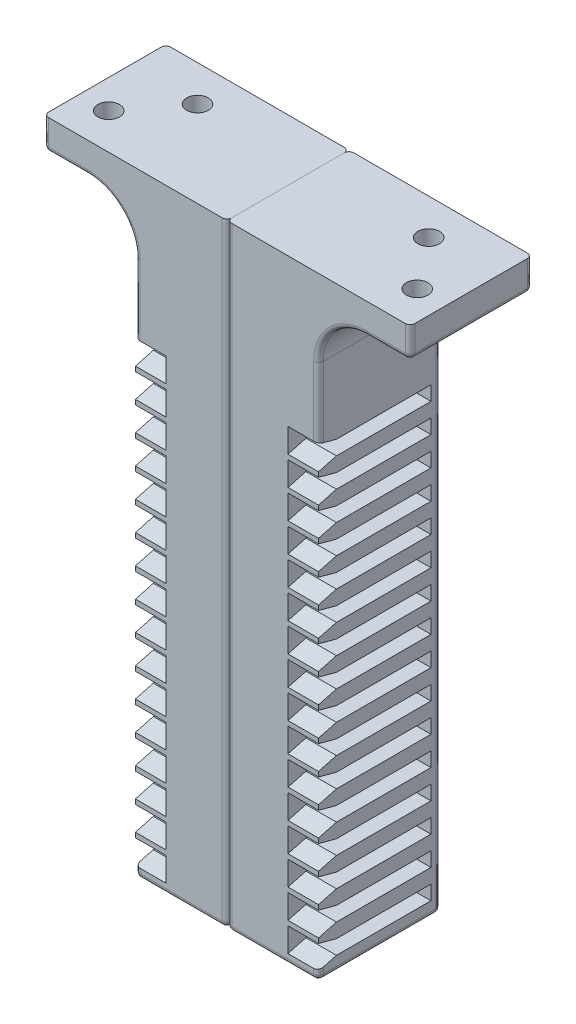
from build123d import *

# Parameters (mm, degrees)
BOSS_EXTRUDE1_DEPTH                             = 12.7
CHAMFER1_SIZE                                   = 1
CHAMFER1_SIZE2                                  = 3.732050808
FILLET1_R                                       = 10
FILLET2_R                                       = 1
CSK_FOR_M4_FLAT_HEAD_MACHINE_SCREW1_D           = 4.5
CSK_FOR_M4_FLAT_HEAD_MACHINE_SCREW1_CSINK_D     = 9.4
CSK_FOR_M4_FLAT_HEAD_MACHINE_SCREW1_CSINK_ANGLE = 90
BOSS_EXTRUDE2_REACH                             = 106.062
SKETCH5_W                                       = 6.35
SKETCH5_H                                       = 2
FILLET3_R                                       = 1


with BuildPart() as part:
    # Sketch1 → Boss-Extrude1 (new, symmetric)
    with BuildSketch(Plane.XY):
        Polygon((0, 0), (38.1, 0), (38.1, -6.35), (19.05, -6.35), (19.05, -31.75), (12.7, -31.75), (12.7, -34.75), (19.05, -34.75), (19.05, -37.75), (12.7, -37.75), (12.7, -40.75), (19.05, -40.75), (19.05, -43.75), (12.7, -43.75), (12.7, -46.75), (19.05, -46.75), (19.05, -49.75), (12.7, -49.75), (12.7, -52.75), (19.05, -52.75), (19.05, -55.75), (12.7, -55.75), (12.7, -58.75), (19.05, -58.75), (19.05, -61.75), (12.7, -61.75), (12.7, -64.75), (19.05, -64.75), (19.05, -67.75), (12.7, -67.75), (12.7, -70.75), (19.05, -70.75), (19.05, -73.75), (12.7, -73.75), (12.7, -76.75), (19.05, -76.75), (19.05, -79.75), (12.7, -79.75), (12.7, -82.75), (19.05, -82.75), (19.05, -85.75), (12.7, -85.75), (12.7, -88.75), (19.05, -88.75), (19.05, -91.75), (12.7, -91.75), (12.7, -94.75), (19.05, -94.75), (19.05, -97.75), (12.7, -97.75), (12.7, -100.75), (19.05, -100.75), (19.05, -103.75), (12.7, -103.75), (12.7, -106.75), (19.05, -106.75), (19.05, -109.75), (12.7, -109.75), (12.7, -112.75), (19.05, -112.75), (19.05, -115.75), (12.7, -115.75), (12.7, -118.75), (19.05, -118.75), (19.05, -121.75), (12.7, -121.75), (12.7, -124.75), (19.05, -124.75), (19.05, -127.75), (0, -127.75), align=None)
    extrude(amount=BOSS_EXTRUDE1_DEPTH, both=True)

    # Chamfer1
    chamfer1_edges = [part.edges().sort_by_distance(p)[0] for p in [
        (15.875, -64.75, 12.7),
        (15.875, -67.75, 12.7),
        (15.875, -70.75, 12.7),
        (15.875, -73.75, 12.7),
        (15.875, -31.75, 12.7),
        (15.875, -76.75, 12.7),
        (15.875, -79.75, 12.7),
        (15.875, -82.75, 12.7),
        (15.875, -85.75, 12.7),
        (15.875, -88.75, 12.7),
        (15.875, -91.75, 12.7),
        (15.875, -94.75, 12.7),
        (15.875, -97.75, 12.7),
        (15.875, -100.75, 12.7),
        (15.875, -103.75, 12.7),
        (15.875, -34.75, 12.7),
        (15.875, -106.75, 12.7),
        (15.875, -109.75, 12.7),
        (15.875, -112.75, 12.7),
        (15.875, -115.75, 12.7),
        (15.875, -118.75, 12.7),
        (15.875, -121.75, 12.7),
        (15.875, -124.75, 12.7),
        (15.875, -37.75, 12.7),
        (15.875, -40.75, 12.7),
        (15.875, -43.75, 12.7),
        (15.875, -46.75, 12.7),
        (15.875, -49.75, 12.7),
        (15.875, -52.75, 12.7),
        (15.875, -55.75, 12.7),
        (15.875, -58.75, 12.7),
        (15.875, -61.75, 12.7),
    ]]
    chamfer1_side = [part.faces().sort_by_distance(p)[0] for p in [
        (9.688992379, -58.663780694, 12.7),
    ]]
    chamfer(chamfer1_edges, length=CHAMFER1_SIZE, length2=CHAMFER1_SIZE2, reference=chamfer1_side[0])

    # Fillet1
    fillet1_edges = [part.edges().sort_by_distance(p)[0] for p in [
        (19.05, -6.35, 0),
    ]]
    fillet(fillet1_edges, radius=FILLET1_R)

    # Fillet2
    fillet2_edges = [part.edges().sort_by_distance(p)[0] for p in [
        (9.525, -127.75, -12.7),
        (0, -63.875, -12.7),
        (0, -63.875, 12.7),
        (0, -127.75, 0),
        (9.525, -127.75, 12.7),
        (33.575, -6.35, -12.7),
        (21.978932188, -9.278932188, -12.7),
        (33.575, -6.35, 12.7),
        (21.978932188, -9.278932188, 12.7),
        (38.1, -6.35, 0),
        (19.05, -24.05, -12.7),
        (19.05, -23.55, 12.7),
        (38.1, -3.175, -12.7),
        (38.1, -3.175, 12.7),
    ]]
    fillet(fillet2_edges, radius=FILLET2_R)

    # CSK for M4 Flat Head Machine Screw1 (through all)
    with Locations(Plane.XZ.offset(16.35)):
        with Locations((24.05, -5.21800554), (32.1, 5.21800554)):
            CounterSinkHole(CSK_FOR_M4_FLAT_HEAD_MACHINE_SCREW1_D / 2, CSK_FOR_M4_FLAT_HEAD_MACHINE_SCREW1_CSINK_D / 2, counter_sink_angle=CSK_FOR_M4_FLAT_HEAD_MACHINE_SCREW1_CSINK_ANGLE)

    # Boss-Extrude2: up to this face of the body (flat: up to its plane)
    boss_extrude2_end = Plane(part.part.faces().sort_by_distance((15.875, -124.75, -1.866025404))[0])
    # Sketch5 → Boss-Extrude2 (add, up to the picked face)
    with BuildSketch(Plane.XZ.offset(31.75), mode=Mode.PRIVATE) as boss_extrude2_sk1:
        with Locations((15.875, -11.7)):
            Rectangle(SKETCH5_W, SKETCH5_H)
    boss_extrude2_tool1 = split(extrude(boss_extrude2_sk1.sketch, amount=BOSS_EXTRUDE2_REACH, mode=Mode.PRIVATE), bisect_by=boss_extrude2_end, keep=Keep.BOTH, mode=Mode.PRIVATE)
    add(boss_extrude2_tool1.solids().sort_by(Axis((15.875, -31.75, -11.7), (0, -1, 0)))[0])

    # Fillet3
    fillet3_edges = [part.edges().sort_by_distance(p)[0] for p in [
        (19.05, -126.25, 12.7),
        (19.05, -127.457106781, 12.407106781),
        (19.05, -127.75, 0),
        (19.05, -127.457106781, -12.407106781),
        (19.05, -79.25, -12.7),
    ]]
    fillet(fillet3_edges, radius=FILLET3_R)


with BuildPart() as body_2:
    # Mirror2: mirrored copy
    add(part.part.mirror(Plane(origin=(0, 0, 0), x_dir=(0, 0, 1), z_dir=(1, 0, 0))))


solid = Compound([part.part, body_2.part])
